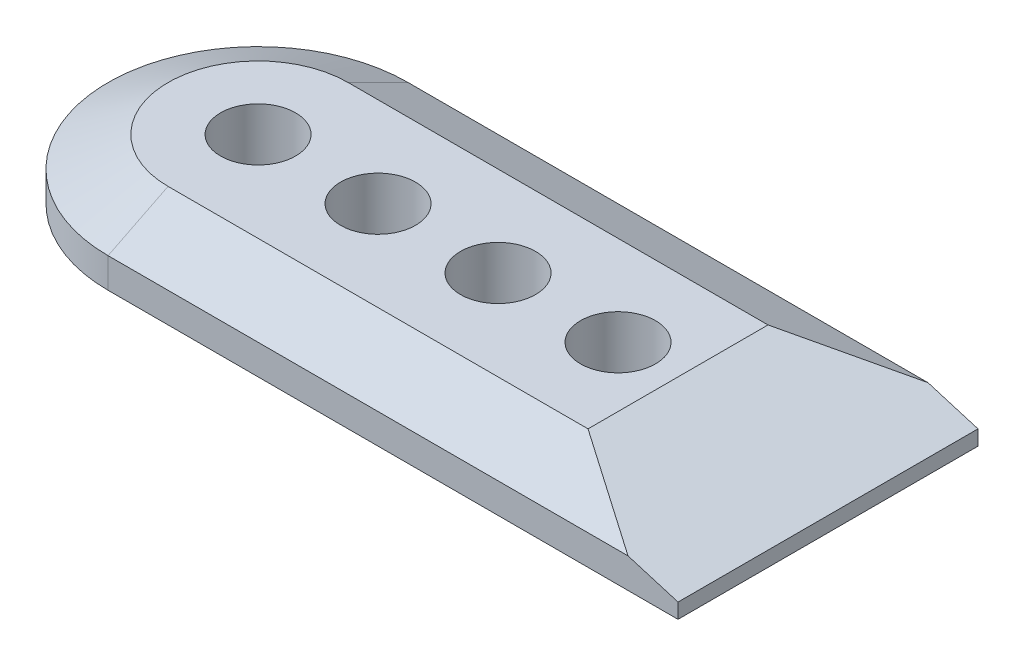
from build123d import *
from OCP.BRepFilletAPI import BRepFilletAPI_MakeChamfer

# Parameters (mm, degrees)
BOSS_EXTRUDE1_DEPTH = 12.7
CHAMFER1_SIZE       = 9.525
CHAMFER1_SIZE2      = 31.75
CHAMFER2_SIZE       = 6.35
CHAMFER2_SIZE2      = 12.7
SKETCH3_R           = 7.9375
CUT_EXTRUDE1_DEPTH  = 166.587741092


with BuildPart() as part:
    # Sketch1 → Boss-Extrude1 (new body)
    with BuildSketch(Plane(origin=(0, 0, 0), x_dir=(1, 0, 0), z_dir=(0, 1, 0))):
        with BuildLine():
            Line((-120.65, 0), (0, 0))
            Line((0, 0), (0, 63.5))
            Line((0, 63.5), (-120.65, 63.5))
            ThreePointArc((-120.65, 63.5), (-152.4, 31.75), (-120.65, 0))
        make_face()
    extrude(amount=BOSS_EXTRUDE1_DEPTH)

    # Chamfer1
    chamfer1_edges = [part.edges().sort_by_distance(p)[0] for p in [
        (0, 12.7, -31.75),
    ]]
    chamfer1_side = [part.faces().sort_by_distance(p)[0] for p in [
        (0, 6.35, -31.75),
    ]]
    chamfer(chamfer1_edges, length=CHAMFER1_SIZE, length2=CHAMFER1_SIZE2, reference=chamfer1_side[0])

    # Chamfer2: one chamfer whose edges measure the first distance from different faces: ONE call of the kernel's chamfer builder (chamfer() names one face for all edges)
    chamfer2_edges_1 = [part.edges().sort_by_distance(p)[0] for p in [
        (-76.2, 12.7, -63.5),
    ]]
    chamfer2_side_1 = [part.faces().sort_by_distance(p)[0] for p in [
        (-65.771167883, 6.002372263, -63.5),
    ]]
    chamfer2_edges_2 = [part.edges().sort_by_distance(p)[0] for p in [
        (-152.4, 12.7, -31.75),
    ]]
    chamfer2_side_2 = [part.faces().sort_by_distance(p)[0] for p in [
        (-152.4, 6.35, -31.75),
    ]]
    chamfer2_edges_3 = [part.edges().sort_by_distance(p)[0] for p in [
        (-76.2, 12.7, 0),
    ]]
    chamfer2_side_3 = [part.faces().sort_by_distance(p)[0] for p in [
        (-65.771167883, 6.002372263, 0),
    ]]
    chamfer2 = BRepFilletAPI_MakeChamfer(part.part.solid().wrapped)
    for e in chamfer2_edges_1:
        chamfer2.Add(CHAMFER2_SIZE, CHAMFER2_SIZE2, e.wrapped, chamfer2_side_1[0].wrapped)  # the first distance lies on this face
    for e in chamfer2_edges_2:
        chamfer2.Add(CHAMFER2_SIZE, CHAMFER2_SIZE2, e.wrapped, chamfer2_side_2[0].wrapped)  # the first distance lies on this face
    for e in chamfer2_edges_3:
        chamfer2.Add(CHAMFER2_SIZE, CHAMFER2_SIZE2, e.wrapped, chamfer2_side_3[0].wrapped)  # the first distance lies on this face
    add(Compound.cast(chamfer2.Shape()), mode=Mode.REPLACE)

    # Sketch3 → Cut-Extrude1 (cut, through all)
    with BuildSketch(Plane(origin=(0, 12.7, 0), x_dir=(1, 0, 0), z_dir=(0, 1, 0))):
        with Locations(Location((-120.65, 31.75, 0), (0, 0, 270))):
            Circle(SKETCH3_R)
        with Locations(Location((-95.25, 31.75, 0), (0, 0, 270))):
            Circle(SKETCH3_R)
        with Locations(Location((-69.85, 31.75, 0), (0, 0, 270))):
            Circle(SKETCH3_R)
        with Locations(Location((-44.45, 31.75, 0), (0, 0, 270))):
            Circle(SKETCH3_R)
    extrude(amount=-CUT_EXTRUDE1_DEPTH, mode=Mode.SUBTRACT)


solid = part.part
